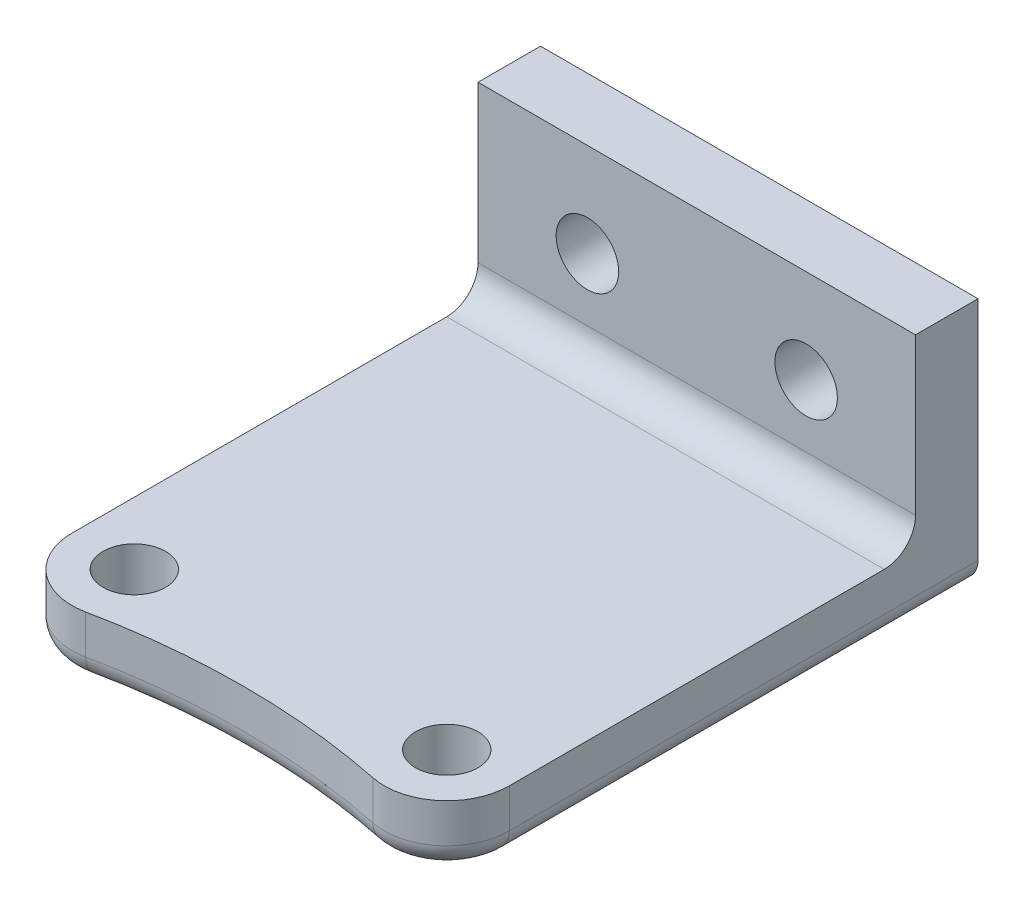
from build123d import *

# Parameters (mm, degrees)
SKETCH1_R           = 2
BOSS_EXTRUDE1_DEPTH = 4
SKETCH2_W           = 28
SKETCH2_H           = 4
BOSS_EXTRUDE2_DEPTH = 12
SKETCH3_R           = 2
CUT_EXTRUDE1_DEPTH  = 4
FILLET1_R           = 1.5
FILLET2_R           = 2


with BuildPart() as part:
    # Sketch1 → Boss-Extrude1 (new body)
    with BuildSketch(Plane(origin=(0, 0, 0), x_dir=(1, 0, 0), z_dir=(0, 1, 0))):
        with BuildLine():
            Line((-4, 0), (-4, 30))
            Line((-4, 30), (24, 30))
            Line((24, 30), (24, 0))
            ThreePointArc((24, 0), (22.528430811, -3.099522162), (19.196481184, -3.918463667))
            ThreePointArc((19.196481184, -3.918463667), (10, -2.985259199), (0.803518816, -3.918463667))
            ThreePointArc((0.803518816, -3.918463667), (-2.528430811, -3.099522162), (-4, 0))
        make_face()
        with Locations(Location((0, 0, 0), (0, 0, 270))):
            Circle(SKETCH1_R, mode=Mode.SUBTRACT)
        with Locations(Location((20, 0, 0), (0, 0, 270))):
            Circle(SKETCH1_R, mode=Mode.SUBTRACT)
    extrude(amount=BOSS_EXTRUDE1_DEPTH)

    # Sketch2 → Boss-Extrude2 (add)
    with BuildSketch(Plane(origin=(0, 4, 0), x_dir=(1, 0, 0), z_dir=(0, 1, 0))):
        with Locations((10, 28)):
            Rectangle(SKETCH2_W, SKETCH2_H)
    extrude(amount=BOSS_EXTRUDE2_DEPTH)

    # Sketch3 → Cut-Extrude1 (cut)
    with BuildSketch(Plane.XY.offset(-26)):
        with Locations((3, 10)):
            Circle(SKETCH3_R)
        with Locations((17, 10)):
            Circle(SKETCH3_R)
    extrude(amount=-CUT_EXTRUDE1_DEPTH, mode=Mode.SUBTRACT)

    # Fillet1
    fillet1_edges = [part.edges().sort_by_distance(p)[0] for p in [
        (-2.528430811, 0, 3.099522162),
        (-4, 0, -15),
        (24, 0, -15),
        (22.528430811, 0, 3.099522162),
        (10, 0, 2.985259199),
    ]]
    fillet(fillet1_edges, radius=FILLET1_R)

    # Fillet2
    fillet2_edges = [part.edges().sort_by_distance(p)[0] for p in [
        (10, 4, -26),
    ]]
    fillet(fillet2_edges, radius=FILLET2_R)


solid = part.part
